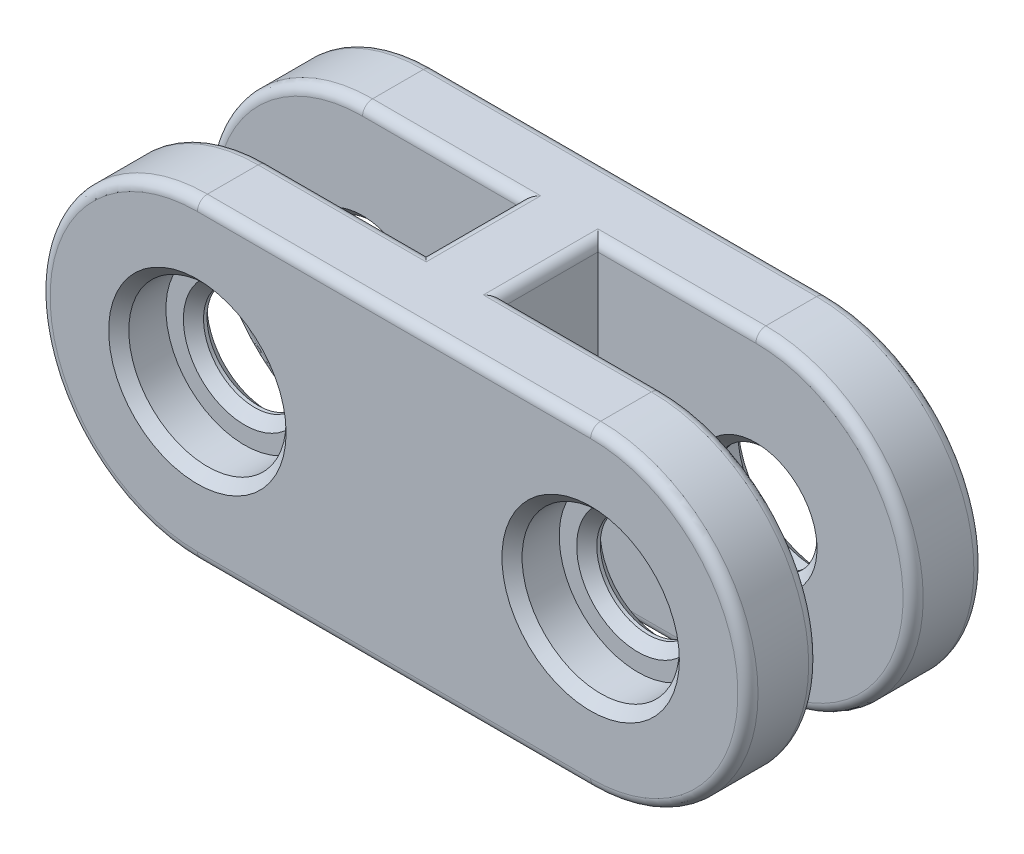
from build123d import *

# Parameters (mm, degrees)
SKETCH1_R           = 4.1275
BOSS_EXTRUDE2_DEPTH = 9.525
SKETCH3_R           = 6.35
CUT_EXTRUDE1_DEPTH  = 3.81
SKETCH4_W           = 33.423596482
SKETCH4_H           = 7.62
CUT_EXTRUDE3_DEPTH  = 53.073871807
FILLET3_R           = 0.8128
CHAMFER5_SIZE       = 0.8128


with BuildPart() as part:
    # Sketch1 → Boss-Extrude2 (new, symmetric)
    with BuildSketch(Plane.XY):
        with BuildLine():
            Line((0, 12.7), (31.75, 12.7))
            ThreePointArc((31.75, 12.7), (44.45, 0), (31.75, -12.7))
            Line((31.75, -12.7), (0, -12.7))
            ThreePointArc((0, -12.7), (-12.7, 0), (0, 12.7))
        make_face()
        with Locations(Location((0, 0, 0), (0, 0, 180))):
            Circle(SKETCH1_R, mode=Mode.SUBTRACT)
        with Locations(Location((31.75, 0, 0), (0, 0, 180))):
            Circle(SKETCH1_R, mode=Mode.SUBTRACT)
    extrude(amount=BOSS_EXTRUDE2_DEPTH, both=True)

    # Sketch3 → Cut-Extrude1 (cut)
    with BuildSketch(Plane.XY.offset(9.525)):
        Circle(SKETCH3_R)
        with Locations((31.75, 0)):
            Circle(SKETCH3_R)
    cut_extrude1 = extrude(amount=-CUT_EXTRUDE1_DEPTH, mode=Mode.SUBTRACT)

    # Mirror1: Cut-Extrude1 across plane
    add(cut_extrude1.mirror(Plane.XY), mode=Mode.SUBTRACT)

    # Sketch4 → Cut-Extrude3 (cut, through all)
    with BuildSketch(Plane(origin=(0, 12.7, 0), x_dir=(1, 0, 0), z_dir=(0, 1, 0))):
        with Locations((35.707937548, 0)):
            Rectangle(SKETCH4_W, SKETCH4_H)
        with Locations((-3.957937548, 0)):
            Rectangle(SKETCH4_W, SKETCH4_H)
    extrude(amount=-CUT_EXTRUDE3_DEPTH, mode=Mode.SUBTRACT)

    # Fillet3
    fillet3_edges = [part.edges().sort_by_distance(p)[0] for p in [
        (44.45, 0, 9.525),
        (15.875, 12.7, 9.525),
        (-12.7, 0, 9.525),
        (15.875, 12.7, -9.525),
        (25.373069653, 12.7, -3.81),
        (6.376930347, 12.7, 3.81),
        (44.45, 0, -9.525),
        (15.875, -12.7, -9.525),
        (-12.7, 0, -9.525),
        (6.376930347, -12.7, -3.81),
        (-12.7, 0, -3.81),
        (-12.7, 0, 3.81),
        (6.376930347, -12.7, 3.81),
        (12.753860693, -12.7, 0),
        (12.753860693, 12.7, 0),
        (6.376930347, 12.7, -3.81),
        (25.373069653, 12.7, 3.81),
        (18.996139307, 12.7, 0),
        (44.45, 0, -3.81),
        (25.373069653, -12.7, -3.81),
        (25.373069653, -12.7, 3.81),
        (44.45, 0, 3.81),
        (15.875, -12.7, 9.525),
        (18.996139307, -12.7, 0),
    ]]
    fillet(fillet3_edges, radius=FILLET3_R)

    # Chamfer5
    chamfer5_edges = [part.edges().sort_by_distance(p)[0] for p in [
        (4.1275, 0, 5.715),
        (-6.35, 0, 9.525),
        (35.8775, 0, 5.715),
        (25.4, 0, 9.525),
        (-6.35, 0, -9.525),
        (4.1275, 0, -5.715),
        (25.4, 0, -9.525),
        (35.8775, 0, -5.715),
        (4.1275, 0, -3.81),
        (4.1275, 0, 3.81),
        (35.8775, 0, -3.81),
        (35.8775, 0, 3.81),
    ]]
    chamfer(chamfer5_edges, length=CHAMFER5_SIZE)


solid = part.part
